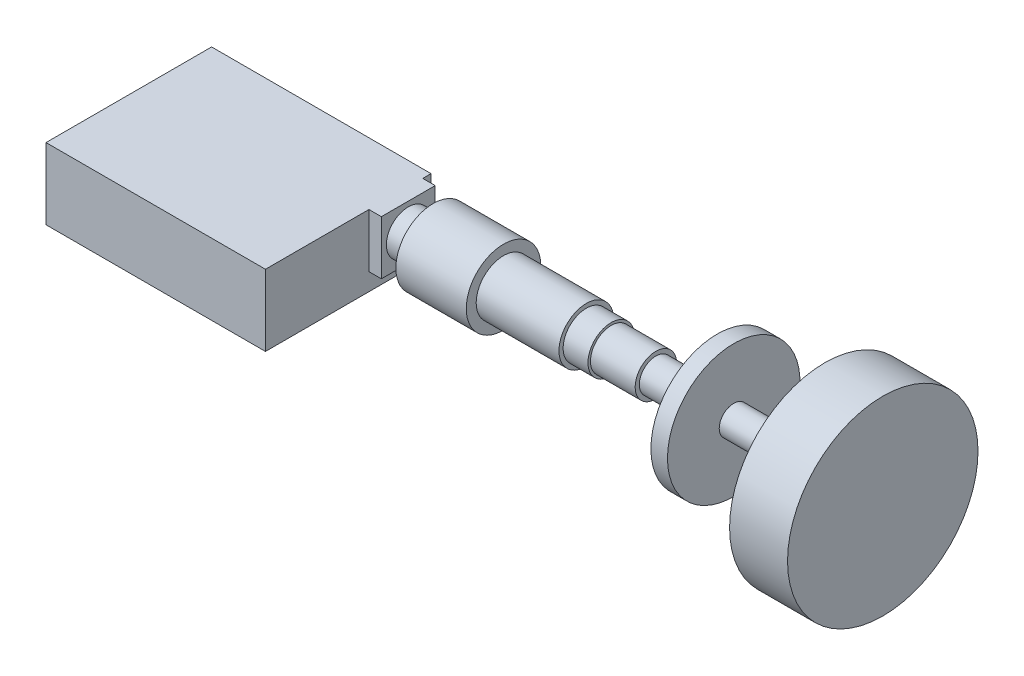
from build123d import *

# Parameters (mm, degrees)
SKETCH1_W           = 26.5
SKETCH1_H           = 20
BOSS_EXTRUDE1_DEPTH = 8.6
SKETCH2_W           = 6.5
SKETCH2_H           = 6.5
BOSS_EXTRUDE2_DEPTH = 1.5


with BuildPart() as part:
    # Sketch1 → Boss-Extrude1 (new body)
    with BuildSketch(Plane(origin=(0, 0, 0), x_dir=(1, 0, 0), z_dir=(0, 1, 0))):
        Rectangle(SKETCH1_W, SKETCH1_H)
    extrude(amount=BOSS_EXTRUDE1_DEPTH)

    # Sketch2 → Boss-Extrude2 (add)
    with BuildSketch(Plane(origin=(13.25, 0, 0), x_dir=(0, 0, -1), z_dir=(1, 0, 0))):
        with Locations((5.75, 5.35)):
            Rectangle(SKETCH2_W, SKETCH2_H)
    extrude(amount=BOSS_EXTRUDE2_DEPTH)

    # Sketch6 → Revolve1 (revolve)
    with BuildSketch(Plane.XY.offset(-5.75), mode=Mode.PRIVATE) as revolve1_sk:
        Polygon((14.75, 5.35), (14.75, 2.7), (17.75, 2.7), (17.75, 0.85), (26.25, 0.85), (26.25, 2.05), (36.25, 2.05), (36.25, 2.55), (39.25, 2.55), (39.25, 2.85), (44.65, 2.85), (44.65, 3.35), (52.05, 3.35), (52.05, -2.65), (54.05, -2.65), (54.05, 3.6), (65.05, 3.6), (65.05, -6.15), (72.05, -6.15), (72.05, 5.35), align=None)
    revolve(revolve1_sk.sketch.rotate(Axis((14.75, 5.35, -5.75), (1, 0, 0)), 270), axis=Axis((14.75, 5.35, -5.75), (1, 0, 0)))


solid = part.part
